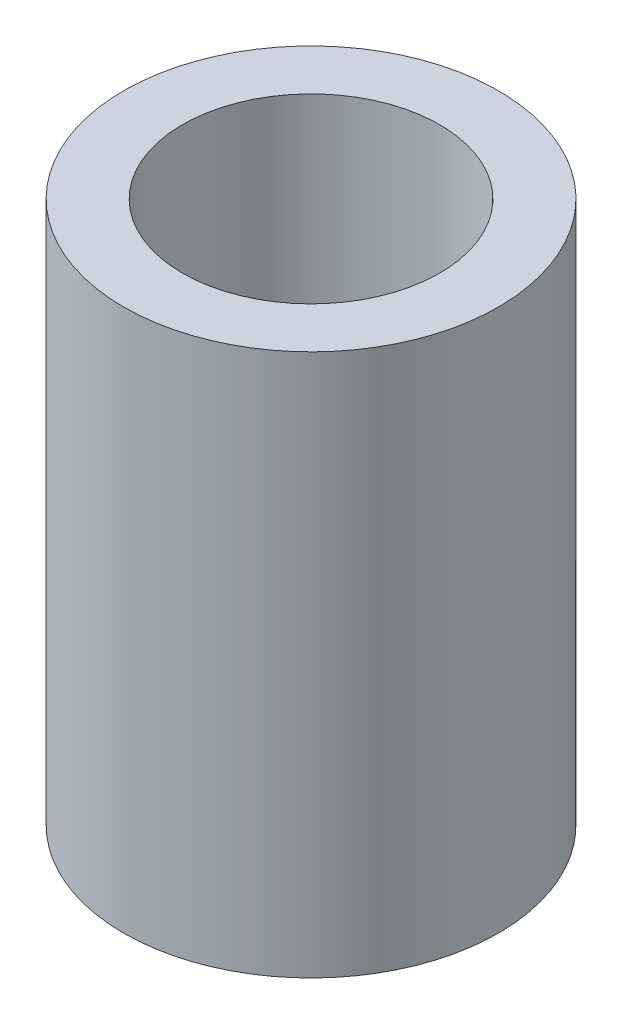
from build123d import *

# Parameters (mm, degrees)
SKETCH1_R           = 8.775
SKETCH1_R_2         = 6.025
BOSS_EXTRUDE1_DEPTH = 25.4


with BuildPart() as part:
    # Sketch1 → Boss-Extrude1 (new body)
    with BuildSketch(Plane(origin=(0, 0, 0), x_dir=(1, 0, 0), z_dir=(0, 1, 0))):
        with Locations(Location((0, 0, 0), (0, 0, 270))):
            Circle(SKETCH1_R)
        with Locations(Location((0, 0, 0), (0, 0, 270))):
            Circle(SKETCH1_R_2, mode=Mode.SUBTRACT)
    extrude(amount=BOSS_EXTRUDE1_DEPTH)


solid = part.part
